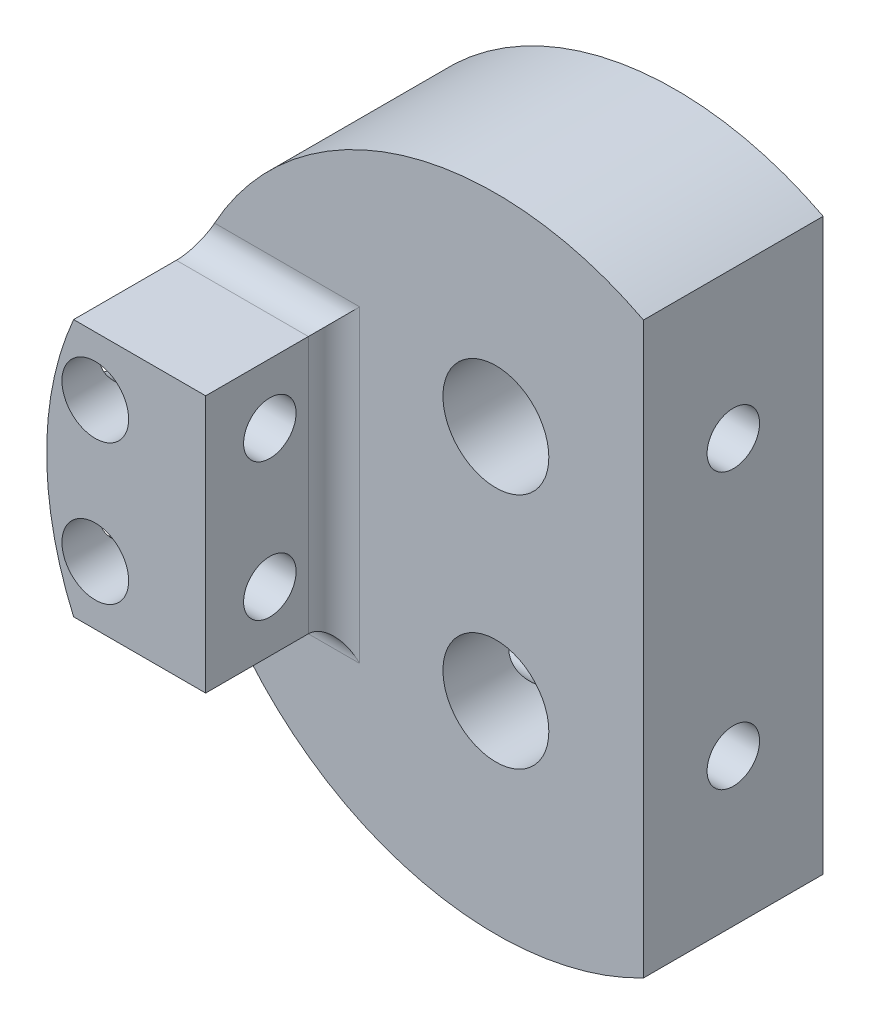
from build123d import *
from build123d.topology import SkipClean

# Parameters (mm, degrees)
SKETCH1_R                       = 25
BOSS_EXTRUDE1_DEPTH             = 14
BOSS_EXTRUDE2_DEPTH             = 10
SKETCH3_R                       = 2.6
F_2_6_MM_FOR_LINEAR_RODS_DEPTH  = 43.731721238
SKETCH4_R                       = 4.125
F_8_25_MM_FOR_LINEAR_RODS_DEPTH = 39.026306684
M3_HOLE_FOR_HEATSET_DEPTH       = 49.220514853
M3_HOLE_FOR_HEATSET_DEPTH_BACK  = 49.220514853
SKETCH5_R                       = 2.045
CUT_EXTRUDE5_START              = -10
CUT_EXTRUDE5_DEPTH              = 10
CUT_EXTRUDE6_START              = -7.5
SKETCH9_W                       = 52.326702075
SKETCH9_H                       = 18.310727006
CUT_EXTRUDE6_DEPTH              = 21
MAGNET_START                    = -13.8
SKETCH10_R                      = 4.1
SKETCH10_W                      = 2.488741119
SKETCH10_H                      = 10.030142225
MAGNET_SLOTS_DEPTH              = 4
FILLET1_R                       = 2


with BuildPart() as part:
    # Sketch1 → Boss-Extrude1 (new body)
    with BuildSketch(Plane(origin=(0, 0, 0), x_dir=(0, 1, 0), z_dir=(0, 0, 1))):
        with Locations(Location((0, 0, 0), (0, 0, 270))):
            Circle(SKETCH1_R)
    extrude(amount=BOSS_EXTRUDE1_DEPTH)

    # Sketch2 → Boss-Extrude2 (add)
    with SkipClean():  # the faces are left unmerged after this step: merging them gives an invalid solid
        with BuildSketch(Plane(origin=(0, 0, 14), x_dir=(0, -1, 0), z_dir=(0, 0, 1))):
            with BuildLine():
                Line((-23.5, -8.529361055), (23.5, -8.529361055))
                ThreePointArc((23.5, -8.529361055), (0, -25), (-23.5, -8.529361055))
            make_face()
        extrude(amount=BOSS_EXTRUDE2_DEPTH)

    # Sketch3 → 2.6 mm for linear rods (cut, through all)
    with SkipClean():  # the faces are left unmerged after this step: merging them gives an invalid solid
        with BuildSketch(Plane.XY.offset(24)):
            with Locations((-21.211258881, -5.45)):
                Circle(SKETCH3_R)
            with Locations(Location((-21.211258881, 5.45, 0), (0, 0, 180))):
                Circle(SKETCH3_R)
        extrude(amount=-F_2_6_MM_FOR_LINEAR_RODS_DEPTH, mode=Mode.SUBTRACT)

    # Sketch4 → 8.25 mm for linear rods (cut, through all)
    with SkipClean():  # the faces are left unmerged after this step: merging them gives an invalid solid
        with BuildSketch(Plane.XY.offset(14)):
            with Locations((0, 9.25)):
                Circle(SKETCH4_R)
            with Locations((0, -9.25)):
                Circle(SKETCH4_R)
        extrude(amount=-F_8_25_MM_FOR_LINEAR_RODS_DEPTH, mode=Mode.SUBTRACT)

    # Sketch5 → M3 Hole for heatset (cut, two sides: drawn at the far end of the back side and taken through both)
    with SkipClean():  # the faces are left unmerged after this step: merging them gives an invalid solid
        with BuildSketch(Plane.YZ.offset(-8.529361055).offset(-M3_HOLE_FOR_HEATSET_DEPTH_BACK)):
            with Locations(Location((-5.35, 19, 0), (0, 0, 270))):
                Circle(SKETCH5_R)
            with Locations(Location((5.35, 19, 0), (0, 0, 270))):
                Circle(SKETCH5_R)
            with Locations(Location((-10.7125, 7, 0), (0, 0, 270))):
                Circle(SKETCH5_R)
            with Locations(Location((10.7125, 7, 0), (0, 0, 270))):
                Circle(SKETCH5_R)
        extrude(amount=M3_HOLE_FOR_HEATSET_DEPTH + M3_HOLE_FOR_HEATSET_DEPTH_BACK, mode=Mode.SUBTRACT)

    # Sketch7 → Cut-Extrude5 (cut)
    with SkipClean():  # the faces are left unmerged after this step: merging them gives an invalid solid
        with BuildSketch(Plane.XY.offset(24).offset(CUT_EXTRUDE5_START)):
            with BuildLine():
                ThreePointArc((-8.657868285, 23.452959659), (-17.1468082, 18.193047258), (-22.899699713, 10.030142225))
                Line((-22.899699713, 10.030142225), (-12.611258881, 10.030142225))
                Line((-12.611258881, 10.030142225), (-12.611258881, -10.030142225))
                Line((-12.611258881, -10.030142225), (-22.899699713, -10.030142225))
                ThreePointArc((-22.899699713, -10.030142225), (-17.1468082, -18.193047258), (-8.657868285, -23.452959659))
                ThreePointArc((-8.657868285, -23.452959659), (-8.593646856, -23.476567758), (-8.529361055, -23.5))
                Line((-8.529361055, -23.5), (-8.529361055, -10.030142225))
                Line((-8.529361055, -10.030142225), (-8.529361055, 10.030142225))
                Line((-8.529361055, 10.030142225), (-8.529361055, 23.5))
                ThreePointArc((-8.529361055, 23.5), (-8.593646856, 23.476567758), (-8.657868285, 23.452959659))
            make_face()
        extrude(amount=CUT_EXTRUDE5_DEPTH, mode=Mode.SUBTRACT)

    # Sketch9 → Cut-Extrude6 (cut)
    with SkipClean():  # the faces are left unmerged after this step: merging them gives an invalid solid
        with BuildSketch(Plane(origin=(4, 0, 0), x_dir=(0, -1, 0), z_dir=(-1, 0, 0)).offset(CUT_EXTRUDE6_START)):
            with Locations((0.180936037, 6.465430306)):
                Rectangle(SKETCH9_W, SKETCH9_H)
        extrude(amount=-CUT_EXTRUDE6_DEPTH, mode=Mode.SUBTRACT)

    # Sketch10 → Magnet Slots (cut)
    with SkipClean():  # the faces are left unmerged after this step: merging them gives an invalid solid
        with BuildSketch(Plane.XY.offset(14).offset(MAGNET_START)):
            with BuildLine():
                ThreePointArc((-15.1, -10.1), (-9.975, -15.225), (-4.85, -10.1))
                Line((-4.85, -10.1), (-4.85, 0))
                Line((-4.85, 0), (-12.611258881, 0))
                Line((-12.611258881, 0), (-12.611258881, -10.030142225))
                Line((-12.611258881, -10.030142225), (-15.1, -10.030142225))
                Line((-15.1, -10.030142225), (-15.1, -10.1))
            make_face()
            with Locations((5.098982217, -18.01996951)):
                Circle(SKETCH10_R)
            with Locations((6.207010352, 0)):
                Circle(SKETCH10_R)
            with Locations((5.098982217, 18.01996951)):
                Circle(SKETCH10_R)
            with BuildLine():
                Line((-12.611258881, 0), (-4.85, 0))
                Line((-4.85, 0), (-4.85, 10.1))
                ThreePointArc((-4.85, 10.1), (-9.975, 15.225), (-15.1, 10.1))
                Line((-15.1, 10.1), (-15.1, 10.030142225))
                Line((-15.1, 10.030142225), (-12.611258881, 10.030142225))
                Line((-12.611258881, 10.030142225), (-12.611258881, 0))
            make_face()
            with Locations((-13.855629441, 5.015071113)):
                Rectangle(SKETCH10_W, SKETCH10_H)
            with Locations((-13.855629441, -5.015071113)):
                Rectangle(SKETCH10_W, SKETCH10_H)
        extrude(amount=MAGNET_SLOTS_DEPTH, mode=Mode.SUBTRACT)

    # Fillet1
    fillet1_edges = [part.edges().sort_by_distance(p)[0] for p in [
        (-12.611258881, 0, 14),
        (-17.755479297, 10.030142225, 14),
        (-17.755479297, -10.030142225, 14),
    ]]
    fillet(fillet1_edges, radius=FILLET1_R)


solid = part.part
